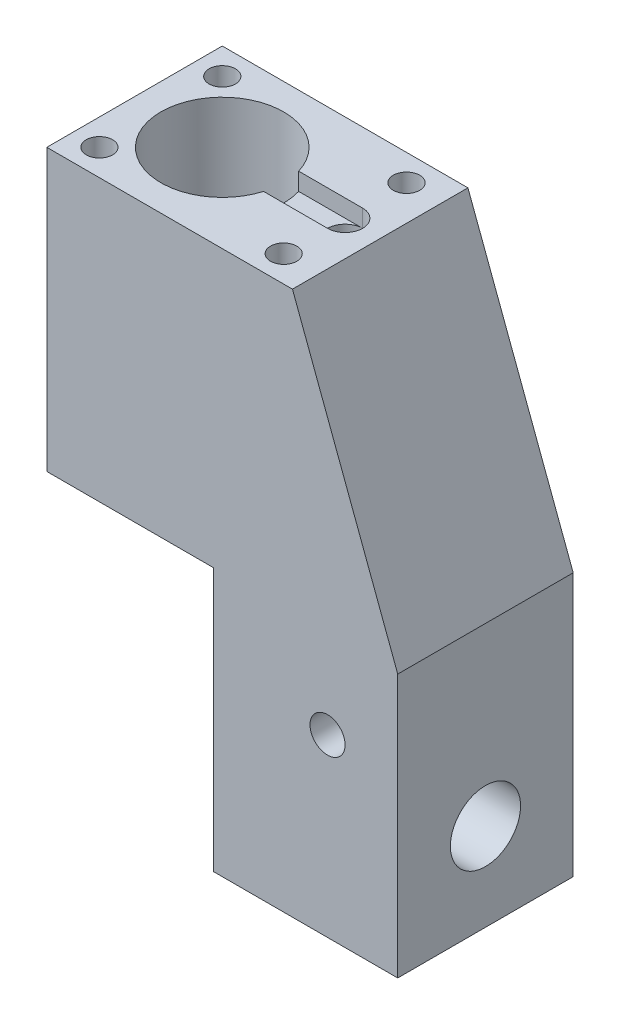
from build123d import *

# Parameters (mm, degrees)
BOSS_EXTRUDE1_DEPTH         = 20
SKETCH2_R                   = 7
CUT_EXTRUDE1_DEPTH          = 77.446059414
SKETCH3_R                   = 4
CUT_EXTRUDE2_DEPTH          = 55.990908339
SKETCH4_R                   = 2
CUT_EXTRUDE3_DEPTH          = 30
CUT_EXTRUDE5_DEPTH          = 2
SKETCH6_R                   = 2
CUT_EXTRUDE6_DEPTH          = 55.990908339
CUT_EXTRUDE7_REACH          = 56.991
CUT_EXTRUDE7_END_RADIUS     = 7
SKETCH7_R                   = 1.6
M3_TAPPED_HOLE1_D           = 2.5
M3_TAPPED_HOLE1_DEPTH       = 7.5
M3_TAPPED_HOLE1_CBORE_D     = 3
M3_TAPPED_HOLE1_CBORE_DEPTH = 6
M3_TAPPED_HOLE1_TIP         = 0.751075774
CUT_EXTRUDE8_START          = -20
SKETCH11_R                  = 2
CUT_EXTRUDE8_DEPTH          = 20
SKETCH12_R                  = 1.5
CUT_EXTRUDE9_DEPTH          = 12


with BuildPart() as part:
    # Sketch1 → Boss-Extrude1 (new body)
    with BuildSketch(Plane.XY):
        Polygon((0, 0), (0, -30), (-21, -30), (-21, 0), (-40, 0), (-40, 32), (-12, 32), align=None)
    extrude(amount=BOSS_EXTRUDE1_DEPTH)

    # Sketch2 → Cut-Extrude1 (cut, through all)
    with BuildSketch(Plane(origin=(0, 32, 0), x_dir=(1, 0, 0), z_dir=(0, 1, 0))):
        with Locations(Location((-30, -10, 0), (0, 0, 270))):
            Circle(SKETCH2_R)
    extrude(amount=-CUT_EXTRUDE1_DEPTH, mode=Mode.SUBTRACT)

    # Sketch3 → Cut-Extrude2 (cut, through all)
    with BuildSketch(Plane(origin=(0, 0, 0), x_dir=(0, 0, -1), z_dir=(1, 0, 0))):
        with Locations(Location((-10, -20, 0), (0, 0, 90))):
            Circle(SKETCH3_R)
    extrude(amount=-CUT_EXTRUDE2_DEPTH, mode=Mode.SUBTRACT)

    # Sketch4 → Cut-Extrude3 (cut)
    with BuildSketch(Plane(origin=(0, 32, 0), x_dir=(1, 0, 0), z_dir=(0, 1, 0))):
        with Locations(Location((-16, -10, 0), (0, 0, 270))):
            Circle(SKETCH4_R)
    extrude(amount=-CUT_EXTRUDE3_DEPTH, mode=Mode.SUBTRACT)

    # Sketch5 → Cut-Extrude5 (cut)
    with BuildSketch(Plane(origin=(0, 32, 0), x_dir=(1, 0, 0), z_dir=(0, 1, 0))):
        with BuildLine():
            Line((-16, -12), (-23.291796068, -12))
            ThreePointArc((-23.291796068, -12), (-23, -10), (-23.291796068, -8))
            Line((-23.291796068, -8), (-16, -8))
            ThreePointArc((-16, -8), (-14, -10), (-16, -12))
        make_face()
    extrude(amount=-CUT_EXTRUDE5_DEPTH, mode=Mode.SUBTRACT)

    # Sketch6 → Cut-Extrude6 (cut, through all)
    with BuildSketch(Plane.XY.offset(20)):
        with Locations((-8, -10)):
            Circle(SKETCH6_R)
    extrude(amount=-CUT_EXTRUDE6_DEPTH, mode=Mode.SUBTRACT)

    # Cut-Extrude7: up to this cylinder (the profile starts outside it)
    cut_extrude7_end = Plane(origin=(-30, 15, 10), z_dir=(0, 1, 0)) * Cylinder(CUT_EXTRUDE7_END_RADIUS, 128.982, mode=Mode.PRIVATE)
    # Sketch7 → Cut-Extrude7 (cut, up to the surface)
    with BuildSketch(Plane.ZY.offset(40), mode=Mode.PRIVATE) as cut_extrude7_sk1:
        with Locations((7, 15)):
            Circle(SKETCH7_R)
    cut_extrude7_tool1 = extrude(cut_extrude7_sk1.sketch, amount=-CUT_EXTRUDE7_REACH, mode=Mode.PRIVATE) - cut_extrude7_end
    add(cut_extrude7_tool1.solids().sort_by_distance((-40, 15, 7))[0], mode=Mode.SUBTRACT)
    # Sketch7 → Cut-Extrude7 (cut, up to the surface)
    with BuildSketch(Plane.ZY.offset(40), mode=Mode.PRIVATE) as cut_extrude7_sk2:
        with Locations((13, 15)):
            Circle(SKETCH7_R)
    cut_extrude7_tool2 = extrude(cut_extrude7_sk2.sketch, amount=-CUT_EXTRUDE7_REACH, mode=Mode.PRIVATE) - cut_extrude7_end
    add(cut_extrude7_tool2.solids().sort_by_distance((-40, 15, 13))[0], mode=Mode.SUBTRACT)

    # M3 Tapped Hole1
    with Locations(Plane(origin=(0, 32, 0), x_dir=(1, 0, 0), z_dir=(0, 1, 0))):
        with Locations((-37, -3), (-16, -3), (-16, -17), (-37, -17)):
            CounterBoreHole(M3_TAPPED_HOLE1_D / 2, M3_TAPPED_HOLE1_CBORE_D / 2, M3_TAPPED_HOLE1_CBORE_DEPTH, depth=M3_TAPPED_HOLE1_DEPTH)
            with Locations((0, 0, -(M3_TAPPED_HOLE1_DEPTH + M3_TAPPED_HOLE1_TIP / 2))):  # 118° drill point
                Cone(0, M3_TAPPED_HOLE1_D / 2, M3_TAPPED_HOLE1_TIP, mode=Mode.SUBTRACT)

    # Sketch11 → Cut-Extrude8 (cut)
    with BuildSketch(Plane.XZ.offset(30).offset(CUT_EXTRUDE8_START)):
        with Locations((-8, 10)):
            Circle(SKETCH11_R)
        with Locations(Location((-16, 10, 0), (0, 0, 90))):
            Circle(SKETCH11_R)
    extrude(amount=CUT_EXTRUDE8_DEPTH, mode=Mode.SUBTRACT)

    # Sketch12 → Cut-Extrude9 (cut)
    with BuildSketch(Plane(origin=(0, 2, 0), x_dir=(1, 0, 0), z_dir=(0, 1, 0))):
        with Locations(Location((-16, -10, 0), (0, 0, 270))):
            Circle(SKETCH12_R)
    extrude(amount=-CUT_EXTRUDE9_DEPTH, mode=Mode.SUBTRACT)


solid = part.part
